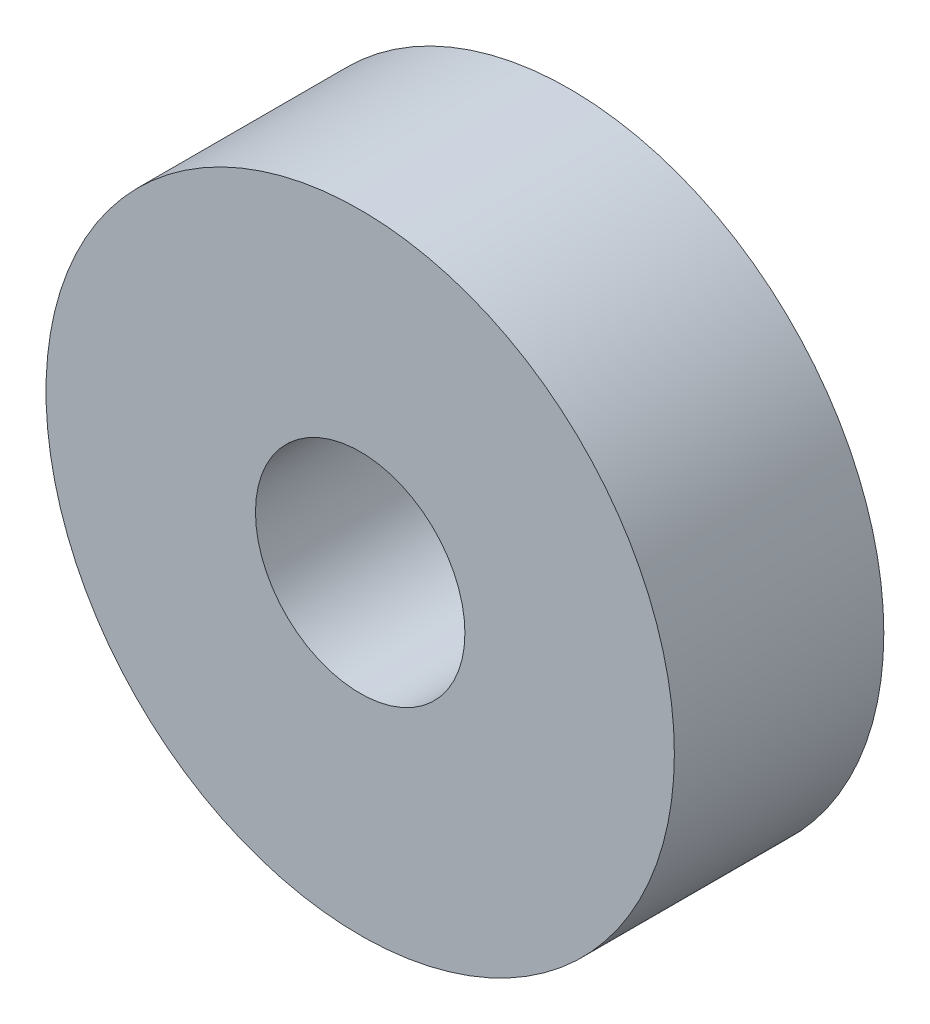
from build123d import *

# Parameters (mm, degrees)
SKETCH1_R           = 14.25
SKETCH1_R_2         = 4.75
BOSS_EXTRUDE1_DEPTH = 4.75


with BuildPart() as part:
    # Sketch1 → Boss-Extrude1 (new, symmetric)
    with BuildSketch(Plane.XY):
        Circle(SKETCH1_R)
        Circle(SKETCH1_R_2, mode=Mode.SUBTRACT)
    extrude(amount=BOSS_EXTRUDE1_DEPTH, both=True)


solid = part.part
